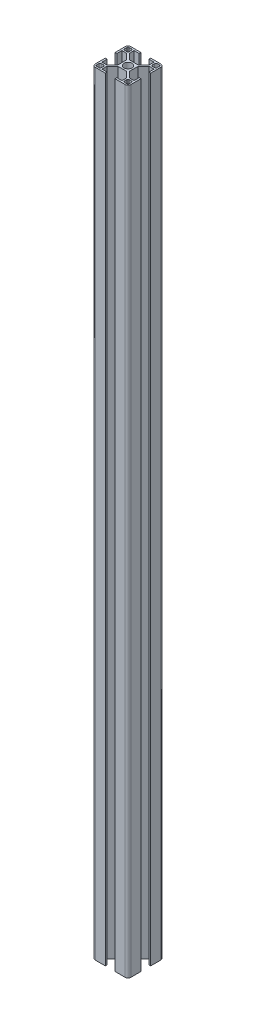
from build123d import *

# Parameters (mm, degrees)
SKETCH_1_R      = 3.4
EXTRUDE_1_DEPTH = 650


with BuildPart() as part:
    # 草图1 → 凸台-拉伸1 (new body)
    with BuildSketch(Plane(origin=(0, 0, 0), x_dir=(1, 0, 0), z_dir=(0, 1, 0))):
        with BuildLine():
            Line((-4.1, 15), (-12.5, 15))
            ThreePointArc((-12.5, 15), (-14.267766953, 14.267766953), (-15, 12.5))
            Line((-15, 12.5), (-15, 4.1))
            Line((-15, 4.1), (-13.5, 4.1))
            Line((-13.5, 4.1), (-13.5, 8.4))
            Line((-13.5, 8.4), (-9.460660172, 8.4))
            Line((-9.460660172, 8.4), (-4.75, 3.689339828))
            Line((-4.75, 3.689339828), (-4.75, -3.689339828))
            Line((-4.75, -3.689339828), (-9.460660172, -8.4))
            Line((-9.460660172, -8.4), (-13.5, -8.4))
            Line((-13.5, -8.4), (-13.5, -4.1))
            Line((-13.5, -4.1), (-15, -4.1))
            Line((-15, -4.1), (-15, -12.5))
            ThreePointArc((-15, -12.5), (-14.267766953, -14.267766953), (-12.5, -15))
            Line((-12.5, -15), (-4.1, -15))
            Line((-4.1, -15), (-4.1, -13.5))
            Line((-4.1, -13.5), (-8.4, -13.5))
            Line((-8.4, -13.5), (-8.4, -9.460660172))
            Line((-8.4, -9.460660172), (-3.689339828, -4.75))
            Line((-3.689339828, -4.75), (3.689339828, -4.75))
            Line((3.689339828, -4.75), (8.4, -9.460660172))
            Line((8.4, -9.460660172), (8.4, -13.5))
            Line((8.4, -13.5), (4.1, -13.5))
            Line((4.1, -13.5), (4.1, -15))
            Line((4.1, -15), (12.5, -15))
            ThreePointArc((12.5, -15), (14.267766953, -14.267766953), (15, -12.5))
            Line((15, -12.5), (15, -4.1))
            Line((15, -4.1), (13.5, -4.1))
            Line((13.5, -4.1), (13.5, -8.4))
            Line((13.5, -8.4), (9.460660172, -8.4))
            Line((9.460660172, -8.4), (4.75, -3.689339828))
            Line((4.75, -3.689339828), (4.75, 3.689339828))
            Line((4.75, 3.689339828), (9.460660172, 8.4))
            Line((9.460660172, 8.4), (13.5, 8.4))
            Line((13.5, 8.4), (13.5, 4.1))
            Line((13.5, 4.1), (15, 4.1))
            Line((15, 4.1), (15, 12.5))
            ThreePointArc((15, 12.5), (14.267766953, 14.267766953), (12.5, 15))
            Line((12.5, 15), (4.1, 15))
            Line((4.1, 15), (4.1, 13.5))
            Line((4.1, 13.5), (8.4, 13.5))
            Line((8.4, 13.5), (8.4, 9.460660172))
            Line((8.4, 9.460660172), (3.689339828, 4.75))
            Line((3.689339828, 4.75), (-3.689339828, 4.75))
            Line((-3.689339828, 4.75), (-8.4, 9.460660172))
            Line((-8.4, 9.460660172), (-8.4, 13.5))
            Line((-8.4, 13.5), (-4.1, 13.5))
            Line((-4.1, 13.5), (-4.1, 15))
        make_face()
        with Locations(Location((0, 0, 0), (0, 0, 270))):
            Circle(SKETCH_1_R, mode=Mode.SUBTRACT)
        with BuildLine():
            Line((-10.7, 13.7), (-12.7, 13.7))
            ThreePointArc((-12.7, 13.7), (-13.407106781, 13.407106781), (-13.7, 12.7))
            Line((-13.7, 12.7), (-13.7, 10.7))
            ThreePointArc((-13.7, 10.7), (-13.407106781, 9.992893219), (-12.7, 9.7))
            Line((-12.7, 9.7), (-10.7, 9.7))
            ThreePointArc((-10.7, 9.7), (-9.992893219, 9.992893219), (-9.7, 10.7))
            Line((-9.7, 10.7), (-9.7, 12.7))
            ThreePointArc((-9.7, 12.7), (-9.992893219, 13.407106781), (-10.7, 13.7))
        make_face(mode=Mode.SUBTRACT)
        with BuildLine():
            Line((13.7, 10.7), (13.7, 12.7))
            ThreePointArc((13.7, 12.7), (13.407106781, 13.407106781), (12.7, 13.7))
            Line((12.7, 13.7), (10.7, 13.7))
            ThreePointArc((10.7, 13.7), (9.992893219, 13.407106781), (9.7, 12.7))
            Line((9.7, 12.7), (9.7, 10.7))
            ThreePointArc((9.7, 10.7), (9.992893219, 9.992893219), (10.7, 9.7))
            Line((10.7, 9.7), (12.7, 9.7))
            ThreePointArc((12.7, 9.7), (13.407106781, 9.992893219), (13.7, 10.7))
        make_face(mode=Mode.SUBTRACT)
        with BuildLine():
            Line((10.7, -13.7), (12.7, -13.7))
            ThreePointArc((12.7, -13.7), (13.407106781, -13.407106781), (13.7, -12.7))
            Line((13.7, -12.7), (13.7, -10.7))
            ThreePointArc((13.7, -10.7), (13.407106781, -9.992893219), (12.7, -9.7))
            Line((12.7, -9.7), (10.7, -9.7))
            ThreePointArc((10.7, -9.7), (9.992893219, -9.992893219), (9.7, -10.7))
            Line((9.7, -10.7), (9.7, -12.7))
            ThreePointArc((9.7, -12.7), (9.992893219, -13.407106781), (10.7, -13.7))
        make_face(mode=Mode.SUBTRACT)
        with BuildLine():
            Line((-13.7, -10.7), (-13.7, -12.7))
            ThreePointArc((-13.7, -12.7), (-13.407106781, -13.407106781), (-12.7, -13.7))
            Line((-12.7, -13.7), (-10.7, -13.7))
            ThreePointArc((-10.7, -13.7), (-9.992893219, -13.407106781), (-9.7, -12.7))
            Line((-9.7, -12.7), (-9.7, -10.7))
            ThreePointArc((-9.7, -10.7), (-9.992893219, -9.992893219), (-10.7, -9.7))
            Line((-10.7, -9.7), (-12.7, -9.7))
            ThreePointArc((-12.7, -9.7), (-13.407106781, -9.992893219), (-13.7, -10.7))
        make_face(mode=Mode.SUBTRACT)
    extrude(amount=EXTRUDE_1_DEPTH)


solid = part.part
